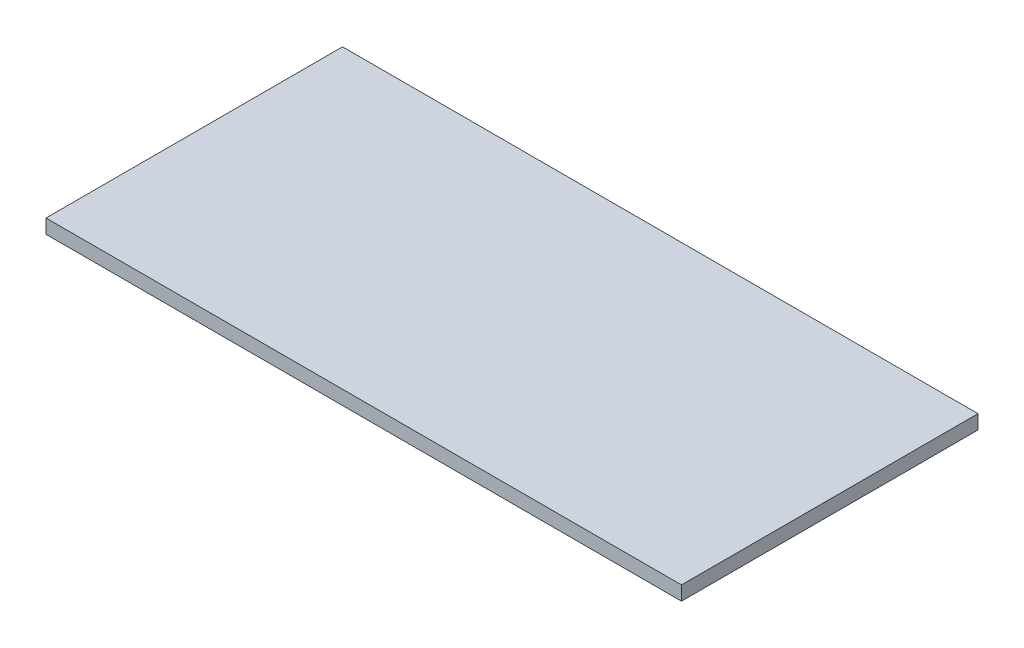
from build123d import *

# Parameters (mm, degrees)
SKETCH_1_W      = 90
SKETCH_1_H      = 42
EXTRUDE_1_DEPTH = 2


with BuildPart() as part:
    # 草图1 → 凸台-拉伸1 (new body)
    with BuildSketch(Plane(origin=(0, 0, 0), x_dir=(1, 0, 0), z_dir=(0, 1, 0))):
        with Locations((-2.181466113, 3.064579662)):
            Rectangle(SKETCH_1_W, SKETCH_1_H)
    extrude(amount=EXTRUDE_1_DEPTH)


solid = part.part
